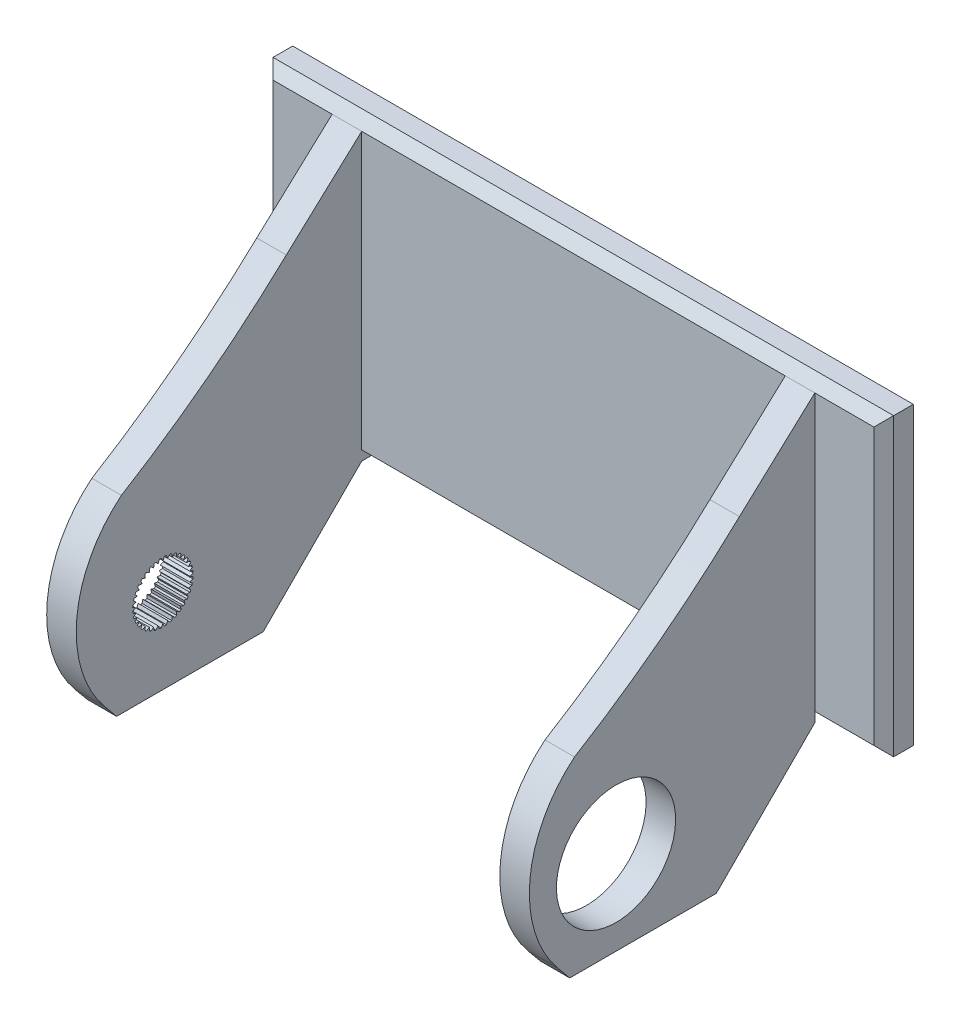
from build123d import *

# Parameters (mm, degrees)
SKETCH2_W           = 63
SKETCH2_H           = 30
BOSS_EXTRUDE2_DEPTH = 3
SKETCH6_W           = 3
SKETCH6_H           = 30
BOSS_EXTRUDE5_DEPTH = 20
SKETCH7_W           = 3
SKETCH7_H           = 23
BOSS_EXTRUDE6_DEPTH = 10
SKETCH8_W           = 3
SKETCH8_H           = 40
BOSS_EXTRUDE7_DEPTH = 15
CUT_EXTRUDE2_DEPTH  = 15
CUT_EXTRUDE3_DEPTH  = 15
CHAMFER2_SIZE       = 1
CUT_EXTRUDE4_DEPTH  = 15
SKETCH12_R          = 6.05
CUT_EXTRUDE5_DEPTH  = 10


with BuildPart() as part:
    # Sketch2 → Boss-Extrude2 (new body)
    with BuildSketch(Plane.XY):
        Rectangle(SKETCH2_W, SKETCH2_H)
    extrude(amount=BOSS_EXTRUDE2_DEPTH)

    # Sketch6 → Boss-Extrude5 (add)
    with BuildSketch(Plane.XY.offset(3)):
        with Locations((-23, 0)):
            Rectangle(SKETCH6_W, SKETCH6_H)
    boss_extrude5 = extrude(amount=BOSS_EXTRUDE5_DEPTH)

    # Sketch7 → Boss-Extrude6 (add)
    with BuildSketch(Plane.XZ.offset(15)):
        with Locations((-23, 11.5)):
            Rectangle(SKETCH7_W, SKETCH7_H)
    boss_extrude6 = extrude(amount=BOSS_EXTRUDE6_DEPTH)

    # Sketch8 → Boss-Extrude7 (add)
    with BuildSketch(Plane.XY.offset(23)):
        with Locations((-23, -5)):
            Rectangle(SKETCH8_W, SKETCH8_H)
    boss_extrude7 = extrude(amount=BOSS_EXTRUDE7_DEPTH)

    # Sketch9 → Cut-Extrude2 (cut)
    with BuildSketch(Plane.ZY.offset(24.5)):
        with BuildLine():
            Line((25.637593138, -14.932048065), (25.683905045, -14.851833488))
            Line((25.683905045, -14.851833488), (25.747581591, -14.741542475))
            ThreePointArc((25.747581591, -14.741542475), (25.693941647, -14.662338413), (25.637860115, -14.584843968))
            Line((25.637860115, -14.584843968), (25.512441803, -14.606958601))
            Line((25.512441803, -14.606958601), (25.421225152, -14.623042557))
            Line((25.421225152, -14.623042557), (25.298780115, -14.644632921))
            Line((25.298780115, -14.644632921), (25.34130483, -14.527797226))
            Line((25.34130483, -14.527797226), (25.372984041, -14.440759311))
            Line((25.372984041, -14.440759311), (25.416541363, -14.32108655))
            ThreePointArc((25.416541363, -14.32108655), (25.349962689, -14.252400254), (25.281276393, -14.18582158))
            Line((25.281276393, -14.18582158), (25.161603633, -14.229378903))
            Line((25.161603633, -14.229378903), (25.074565717, -14.261058113))
            Line((25.074565717, -14.261058113), (24.957730022, -14.303582829))
            Line((24.957730022, -14.303582829), (24.979320386, -14.181137791))
            Line((24.979320386, -14.181137791), (24.995404343, -14.08992114))
            Line((24.995404343, -14.08992114), (25.017518975, -13.964502828))
            ThreePointArc((25.017518975, -13.964502828), (24.940024531, -13.908421297), (24.860820468, -13.854781352))
            Line((24.860820468, -13.854781352), (24.750529456, -13.918457898))
            Line((24.750529456, -13.918457898), (24.670314879, -13.964769806))
            Line((24.670314879, -13.964769806), (24.56263852, -14.02693678))
            Line((24.56263852, -14.02693678), (24.56263852, -13.902602831))
            Line((24.56263852, -13.902602831), (24.56263852, -13.809979016))
            Line((24.56263852, -13.809979016), (24.56263852, -13.682625924))
            ThreePointArc((24.56263852, -13.682625924), (24.476582935, -13.640853166), (24.389267681, -13.601781774))
            Line((24.389267681, -13.601781774), (24.291709553, -13.683642764))
            Line((24.291709553, -13.683642764), (24.220755594, -13.743180204))
            Line((24.220755594, -13.743180204), (24.125510263, -13.823100527))
            Line((24.125510263, -13.823100527), (24.1039199, -13.700655489))
            Line((24.1039199, -13.700655489), (24.087835943, -13.609438838))
            Line((24.087835943, -13.609438838), (24.065721311, -13.484020526))
            ThreePointArc((24.065721311, -13.484020526), (23.973719339, -13.457825786), (23.880945925, -13.434510111))
            Line((23.880945925, -13.434510111), (23.799084936, -13.532068239))
            Line((23.799084936, -13.532068239), (23.739547495, -13.603022198))
            Line((23.739547495, -13.603022198), (23.659627173, -13.698267529))
            Line((23.659627173, -13.698267529), (23.617102458, -13.581431834))
            Line((23.617102458, -13.581431834), (23.585423247, -13.494393919))
            Line((23.585423247, -13.494393919), (23.541865925, -13.374721158))
            ThreePointArc((23.541865925, -13.374721158), (23.446713001, -13.364900349), (23.351300299, -13.358048826))
            Line((23.351300299, -13.358048826), (23.287623753, -13.468339839))
            Line((23.287623753, -13.468339839), (23.241311846, -13.548554415))
            Line((23.241311846, -13.548554415), (23.179144871, -13.656230774))
            Line((23.179144871, -13.656230774), (23.116977896, -13.548554415))
            Line((23.116977896, -13.548554415), (23.070665989, -13.468339839))
            Line((23.070665989, -13.468339839), (23.006989443, -13.358048826))
            ThreePointArc((23.006989443, -13.358048826), (22.911576741, -13.364900349), (22.816423817, -13.374721158))
            Line((22.816423817, -13.374721158), (22.772866495, -13.494393919))
            Line((22.772866495, -13.494393919), (22.741187284, -13.581431834))
            Line((22.741187284, -13.581431834), (22.698662569, -13.698267529))
            Line((22.698662569, -13.698267529), (22.618742247, -13.603022198))
            Line((22.618742247, -13.603022198), (22.559204806, -13.532068239))
            Line((22.559204806, -13.532068239), (22.477343817, -13.434510111))
            ThreePointArc((22.477343817, -13.434510111), (22.384570403, -13.457825786), (22.292568431, -13.484020526))
            Line((22.292568431, -13.484020526), (22.270453799, -13.609438838))
            Line((22.270453799, -13.609438838), (22.254369843, -13.700655489))
            Line((22.254369843, -13.700655489), (22.232779479, -13.823100527))
            Line((22.232779479, -13.823100527), (22.137534148, -13.743180204))
            Line((22.137534148, -13.743180204), (22.066580189, -13.683642764))
            Line((22.066580189, -13.683642764), (21.969022061, -13.601781774))
            ThreePointArc((21.969022061, -13.601781774), (21.881706807, -13.640853166), (21.795651222, -13.682625924))
            Line((21.795651222, -13.682625924), (21.795651222, -13.809979016))
            Line((21.795651222, -13.809979016), (21.795651222, -13.902602831))
            Line((21.795651222, -13.902602831), (21.795651222, -14.02693678))
            Line((21.795651222, -14.02693678), (21.687974863, -13.964769806))
            Line((21.687974863, -13.964769806), (21.607760286, -13.918457898))
            Line((21.607760286, -13.918457898), (21.497469274, -13.854781352))
            ThreePointArc((21.497469274, -13.854781352), (21.418265211, -13.908421297), (21.340770767, -13.964502828))
            Line((21.340770767, -13.964502828), (21.362885399, -14.08992114))
            Line((21.362885399, -14.08992114), (21.378969356, -14.181137791))
            Line((21.378969356, -14.181137791), (21.40055972, -14.303582829))
            Line((21.40055972, -14.303582829), (21.283724025, -14.261058113))
            Line((21.283724025, -14.261058113), (21.196686109, -14.229378903))
            Line((21.196686109, -14.229378903), (21.077013349, -14.18582158))
            ThreePointArc((21.077013349, -14.18582158), (21.008327053, -14.252400254), (20.941748379, -14.32108655))
            Line((20.941748379, -14.32108655), (20.985305701, -14.440759311))
            Line((20.985305701, -14.440759311), (21.016984912, -14.527797226))
            Line((21.016984912, -14.527797226), (21.059509627, -14.644632921))
            Line((21.059509627, -14.644632921), (20.93706459, -14.623042557))
            Line((20.93706459, -14.623042557), (20.845847939, -14.606958601))
            Line((20.845847939, -14.606958601), (20.720429627, -14.584843968))
            ThreePointArc((20.720429627, -14.584843968), (20.664348095, -14.662338413), (20.610708151, -14.741542475))
            Line((20.610708151, -14.741542475), (20.674384697, -14.851833488))
            Line((20.674384697, -14.851833488), (20.720696604, -14.932048065))
            Line((20.720696604, -14.932048065), (20.782863579, -15.039724423))
            Line((20.782863579, -15.039724423), (20.658529629, -15.039724423))
            Line((20.658529629, -15.039724423), (20.565905815, -15.039724423))
            Line((20.565905815, -15.039724423), (20.438552723, -15.039724423))
            ThreePointArc((20.438552723, -15.039724423), (20.396779965, -15.125780009), (20.357708573, -15.213095262))
            Line((20.357708573, -15.213095262), (20.439569562, -15.31065339))
            Line((20.439569562, -15.31065339), (20.499107003, -15.381607349))
            Line((20.499107003, -15.381607349), (20.579027325, -15.47685268))
            Line((20.579027325, -15.47685268), (20.456582288, -15.498443044))
            Line((20.456582288, -15.498443044), (20.365365637, -15.514527001))
            Line((20.365365637, -15.514527001), (20.239947325, -15.536641633))
            ThreePointArc((20.239947325, -15.536641633), (20.213752584, -15.628643604), (20.190436909, -15.721417018))
            Line((20.190436909, -15.721417018), (20.287995038, -15.803278008))
            Line((20.287995038, -15.803278008), (20.358948996, -15.862815448))
            Line((20.358948996, -15.862815448), (20.454194327, -15.942735771))
            Line((20.454194327, -15.942735771), (20.337358632, -15.985260486))
            Line((20.337358632, -15.985260486), (20.250320717, -16.016939696))
            Line((20.250320717, -16.016939696), (20.130647957, -16.060497019))
            ThreePointArc((20.130647957, -16.060497019), (20.120827148, -16.155649942), (20.113975625, -16.251062644))
            Line((20.113975625, -16.251062644), (20.224266637, -16.31473919))
            Line((20.224266637, -16.31473919), (20.304481214, -16.361051098))
            Line((20.304481214, -16.361051098), (20.412157573, -16.423218073))
            Line((20.412157573, -16.423218073), (20.304481214, -16.485385047))
            Line((20.304481214, -16.485385047), (20.224266637, -16.531696955))
            Line((20.224266637, -16.531696955), (20.113975625, -16.595373501))
            ThreePointArc((20.113975625, -16.595373501), (20.120827148, -16.690786203), (20.130647957, -16.785939126))
            Line((20.130647957, -16.785939126), (20.250320717, -16.829496449))
            Line((20.250320717, -16.829496449), (20.337358632, -16.861175659))
            Line((20.337358632, -16.861175659), (20.454194327, -16.903700374))
            Line((20.454194327, -16.903700374), (20.358948996, -16.983620697))
            Line((20.358948996, -16.983620697), (20.287995038, -17.043158137))
            Line((20.287995038, -17.043158137), (20.190436909, -17.125019127))
            ThreePointArc((20.190436909, -17.125019127), (20.213752584, -17.217792541), (20.239947325, -17.309794512))
            Line((20.239947325, -17.309794512), (20.365365637, -17.331909144))
            Line((20.365365637, -17.331909144), (20.456582288, -17.347993101))
            Line((20.456582288, -17.347993101), (20.579027325, -17.369583465))
            Line((20.579027325, -17.369583465), (20.499107003, -17.464828796))
            Line((20.499107003, -17.464828796), (20.439569562, -17.535782755))
            Line((20.439569562, -17.535782755), (20.357708573, -17.633340883))
            ThreePointArc((20.357708573, -17.633340883), (20.396779965, -17.720656136), (20.438552723, -17.806711722))
            Line((20.438552723, -17.806711722), (20.565905815, -17.806711722))
            Line((20.565905815, -17.806711722), (20.658529629, -17.806711722))
            Line((20.658529629, -17.806711722), (20.782863579, -17.806711722))
            Line((20.782863579, -17.806711722), (20.720696604, -17.91438808))
            Line((20.720696604, -17.91438808), (20.674384697, -17.994602657))
            Line((20.674384697, -17.994602657), (20.610708151, -18.10489367))
            ThreePointArc((20.610708151, -18.10489367), (20.664348095, -18.184097732), (20.720429627, -18.261592177))
            Line((20.720429627, -18.261592177), (20.845847939, -18.239477544))
            Line((20.845847939, -18.239477544), (20.93706459, -18.223393588))
            Line((20.93706459, -18.223393588), (21.059509627, -18.201803224))
            Line((21.059509627, -18.201803224), (21.016984912, -18.318638919))
            Line((21.016984912, -18.318638919), (20.985305701, -18.405676834))
            Line((20.985305701, -18.405676834), (20.941748379, -18.525349595))
            ThreePointArc((20.941748379, -18.525349595), (21.008327053, -18.594035891), (21.077013349, -18.660614565))
            Line((21.077013349, -18.660614565), (21.196686109, -18.617057242))
            Line((21.196686109, -18.617057242), (21.283724025, -18.585378032))
            Line((21.283724025, -18.585378032), (21.40055972, -18.542853316))
            Line((21.40055972, -18.542853316), (21.378969356, -18.665298354))
            Line((21.378969356, -18.665298354), (21.362885399, -18.756515005))
            Line((21.362885399, -18.756515005), (21.340770767, -18.881933317))
            ThreePointArc((21.340770767, -18.881933317), (21.418265211, -18.938014848), (21.497469274, -18.991654793))
            Line((21.497469274, -18.991654793), (21.607760286, -18.927978247))
            Line((21.607760286, -18.927978247), (21.687974863, -18.881666339))
            Line((21.687974863, -18.881666339), (21.795651222, -18.819499365))
            Line((21.795651222, -18.819499365), (21.795651222, -18.943833314))
            Line((21.795651222, -18.943833314), (21.795651222, -19.036457129))
            Line((21.795651222, -19.036457129), (21.795651222, -19.163810221))
            ThreePointArc((21.795651222, -19.163810221), (21.881706807, -19.205582979), (21.969022061, -19.244654371))
            Line((21.969022061, -19.244654371), (22.066580189, -19.162793381))
            Line((22.066580189, -19.162793381), (22.137534148, -19.103255941))
            Line((22.137534148, -19.103255941), (22.232779479, -19.023335618))
            Line((22.232779479, -19.023335618), (22.254369843, -19.145780656))
            Line((22.254369843, -19.145780656), (22.270453799, -19.236997307))
            Line((22.270453799, -19.236997307), (22.292568431, -19.362415619))
            ThreePointArc((22.292568431, -19.362415619), (22.384570403, -19.388610359), (22.477343817, -19.411926034))
            Line((22.477343817, -19.411926034), (22.559204806, -19.314367906))
            Line((22.559204806, -19.314367906), (22.618742247, -19.243413947))
            Line((22.618742247, -19.243413947), (22.698662569, -19.148168616))
            Line((22.698662569, -19.148168616), (22.741187284, -19.265004311))
            Line((22.741187284, -19.265004311), (22.772866495, -19.352042226))
            Line((22.772866495, -19.352042226), (22.816423817, -19.471714987))
            ThreePointArc((22.816423817, -19.471714987), (22.911576741, -19.481535796), (23.006989443, -19.488387319))
            Line((23.006989443, -19.488387319), (23.070665989, -19.378096306))
            Line((23.070665989, -19.378096306), (23.116977896, -19.29788173))
            Line((23.116977896, -19.29788173), (23.179144871, -19.190205371))
            Line((23.179144871, -19.190205371), (23.241311846, -19.29788173))
            Line((23.241311846, -19.29788173), (23.287623753, -19.378096306))
            Line((23.287623753, -19.378096306), (23.351300299, -19.488387319))
            ThreePointArc((23.351300299, -19.488387319), (23.446713001, -19.481535796), (23.541865925, -19.471714987))
            Line((23.541865925, -19.471714987), (23.585423247, -19.352042226))
            Line((23.585423247, -19.352042226), (23.617102458, -19.265004311))
            Line((23.617102458, -19.265004311), (23.659627173, -19.148168616))
            Line((23.659627173, -19.148168616), (23.739547495, -19.243413947))
            Line((23.739547495, -19.243413947), (23.799084936, -19.314367906))
            Line((23.799084936, -19.314367906), (23.880945925, -19.411926034))
            ThreePointArc((23.880945925, -19.411926034), (23.973719339, -19.388610359), (24.065721311, -19.362415619))
            Line((24.065721311, -19.362415619), (24.087835943, -19.236997307))
            Line((24.087835943, -19.236997307), (24.1039199, -19.145780656))
            Line((24.1039199, -19.145780656), (24.125510263, -19.023335618))
            Line((24.125510263, -19.023335618), (24.220755594, -19.103255941))
            Line((24.220755594, -19.103255941), (24.291709553, -19.162793381))
            Line((24.291709553, -19.162793381), (24.389267681, -19.244654371))
            ThreePointArc((24.389267681, -19.244654371), (24.476582935, -19.205582979), (24.56263852, -19.163810221))
            Line((24.56263852, -19.163810221), (24.56263852, -19.036457129))
            Line((24.56263852, -19.036457129), (24.56263852, -18.943833314))
            Line((24.56263852, -18.943833314), (24.56263852, -18.819499365))
            Line((24.56263852, -18.819499365), (24.670314879, -18.881666339))
            Line((24.670314879, -18.881666339), (24.750529456, -18.927978247))
            Line((24.750529456, -18.927978247), (24.860820468, -18.991654793))
            ThreePointArc((24.860820468, -18.991654793), (24.940024531, -18.938014848), (25.017518975, -18.881933317))
            Line((25.017518975, -18.881933317), (24.995404343, -18.756515005))
            Line((24.995404343, -18.756515005), (24.979320386, -18.665298354))
            Line((24.979320386, -18.665298354), (24.957730022, -18.542853316))
            Line((24.957730022, -18.542853316), (25.074565717, -18.585378032))
            Line((25.074565717, -18.585378032), (25.161603633, -18.617057242))
            Line((25.161603633, -18.617057242), (25.281276393, -18.660614565))
            ThreePointArc((25.281276393, -18.660614565), (25.349962689, -18.594035891), (25.416541363, -18.525349595))
            Line((25.416541363, -18.525349595), (25.372984041, -18.405676834))
            Line((25.372984041, -18.405676834), (25.34130483, -18.318638919))
            Line((25.34130483, -18.318638919), (25.298780115, -18.201803224))
            Line((25.298780115, -18.201803224), (25.421225152, -18.223393588))
            Line((25.421225152, -18.223393588), (25.512441803, -18.239477544))
            Line((25.512441803, -18.239477544), (25.637860115, -18.261592177))
            ThreePointArc((25.637860115, -18.261592177), (25.693941647, -18.184097732), (25.747581591, -18.10489367))
            Line((25.747581591, -18.10489367), (25.683905045, -17.994602657))
            Line((25.683905045, -17.994602657), (25.637593138, -17.91438808))
            Line((25.637593138, -17.91438808), (25.575426163, -17.806711722))
            Line((25.575426163, -17.806711722), (25.699760113, -17.806711722))
            Line((25.699760113, -17.806711722), (25.792383928, -17.806711722))
            Line((25.792383928, -17.806711722), (25.919737019, -17.806711722))
            ThreePointArc((25.919737019, -17.806711722), (25.961509777, -17.720656136), (26.000581169, -17.633340883))
            Line((26.000581169, -17.633340883), (25.91872018, -17.535782755))
            Line((25.91872018, -17.535782755), (25.859182739, -17.464828796))
            Line((25.859182739, -17.464828796), (25.779262417, -17.369583465))
            Line((25.779262417, -17.369583465), (25.901707454, -17.347993101))
            Line((25.901707454, -17.347993101), (25.992924105, -17.331909144))
            Line((25.992924105, -17.331909144), (26.118342417, -17.309794512))
            ThreePointArc((26.118342417, -17.309794512), (26.144537158, -17.217792541), (26.167852833, -17.125019127))
            Line((26.167852833, -17.125019127), (26.070294704, -17.043158137))
            Line((26.070294704, -17.043158137), (25.999340746, -16.983620697))
            Line((25.999340746, -16.983620697), (25.904095415, -16.903700374))
            Line((25.904095415, -16.903700374), (26.02093111, -16.861175659))
            Line((26.02093111, -16.861175659), (26.107969025, -16.829496449))
            Line((26.107969025, -16.829496449), (26.227641785, -16.785939126))
            ThreePointArc((26.227641785, -16.785939126), (26.237462594, -16.690786203), (26.244314117, -16.595373501))
            Line((26.244314117, -16.595373501), (26.134023105, -16.531696955))
            Line((26.134023105, -16.531696955), (26.053808528, -16.485385047))
            Line((26.053808528, -16.485385047), (25.946132169, -16.423218073))
            Line((25.946132169, -16.423218073), (26.053808528, -16.361051098))
            Line((26.053808528, -16.361051098), (26.134023105, -16.31473919))
            Line((26.134023105, -16.31473919), (26.244314117, -16.251062644))
            ThreePointArc((26.244314117, -16.251062644), (26.237462594, -16.155649942), (26.227641785, -16.060497019))
            Line((26.227641785, -16.060497019), (26.107969025, -16.016939696))
            Line((26.107969025, -16.016939696), (26.02093111, -15.985260486))
            Line((26.02093111, -15.985260486), (25.904095415, -15.942735771))
            Line((25.904095415, -15.942735771), (25.999340746, -15.862815448))
            Line((25.999340746, -15.862815448), (26.070294704, -15.803278008))
            Line((26.070294704, -15.803278008), (26.167852833, -15.721417018))
            ThreePointArc((26.167852833, -15.721417018), (26.144537158, -15.628643604), (26.118342417, -15.536641633))
            Line((26.118342417, -15.536641633), (25.992924105, -15.514527001))
            Line((25.992924105, -15.514527001), (25.901707454, -15.498443044))
            Line((25.901707454, -15.498443044), (25.779262417, -15.47685268))
            Line((25.779262417, -15.47685268), (25.859182739, -15.381607349))
            Line((25.859182739, -15.381607349), (25.91872018, -15.31065339))
            Line((25.91872018, -15.31065339), (26.000581169, -15.213095262))
            ThreePointArc((26.000581169, -15.213095262), (25.961509777, -15.125780009), (25.919737019, -15.039724423))
            Line((25.919737019, -15.039724423), (25.792383928, -15.039724423))
            Line((25.792383928, -15.039724423), (25.699760113, -15.039724423))
            Line((25.699760113, -15.039724423), (25.575426163, -15.039724423))
            Line((25.575426163, -15.039724423), (25.637593138, -14.932048065))
        make_face()
    cut_extrude2 = extrude(amount=-CUT_EXTRUDE2_DEPTH, mode=Mode.SUBTRACT)

    # Sketch10 → Cut-Extrude3 (cut)
    with BuildSketch(Plane.ZY.offset(24.5)):
        with BuildLine():
            ThreePointArc((27.392981546, -5.808626129), (31.91865842, -14.28970274), (29.121768443, -23.48686633))
            Line((29.121768443, -23.48686633), (27.878216059, -25))
            Line((27.878216059, -25), (38, -25))
            Line((38, -25), (38, 15))
            Line((38, 15), (3, 15))
            ThreePointArc((3, 15), (14.365462469, 3.621511227), (27.392981546, -5.808626129))
        make_face()
        Polygon((0, -25), (13, -25), (3, -15), (0, -15), align=None)
    cut_extrude3 = extrude(amount=-CUT_EXTRUDE3_DEPTH, mode=Mode.SUBTRACT)

    # Chamfer2
    chamfer2_edges = [part.edges().sort_by_distance(p)[0] for p in [
        (31.5, 0, 3),
        (5, -15, 3),
        (-28, 15, 3),
        (5, 15, 3),
        (-31.5, 0, 3),
        (-28, -15, 3),
    ]]
    chamfer(chamfer2_edges, length=CHAMFER2_SIZE)

    # Sketch11 → Cut-Extrude4 (cut)
    with BuildSketch(Plane.ZY.offset(24.5)):
        Polygon((2, 15), (3, 14), (12.323915854, 5.411029954), (3, 15), align=None)
    cut_extrude4 = extrude(amount=-CUT_EXTRUDE4_DEPTH, mode=Mode.SUBTRACT)

    # Mirror1: Boss-Extrude5, Boss-Extrude6, Boss-Extrude7 across plane
    add(boss_extrude5.mirror(Plane(origin=(0, 0, 0), x_dir=(0, 0, 1), z_dir=(1, 0, 0))))
    add(boss_extrude6.mirror(Plane(origin=(0, 0, 0), x_dir=(0, 0, 1), z_dir=(1, 0, 0))))
    add(boss_extrude7.mirror(Plane(origin=(0, 0, 0), x_dir=(0, 0, 1), z_dir=(1, 0, 0))))

    # Mirror2: Cut-Extrude2, Cut-Extrude3, Cut-Extrude4 across plane
    add(cut_extrude2.mirror(Plane(origin=(0, 0, 0), x_dir=(0, 0, 1), z_dir=(1, 0, 0))), mode=Mode.SUBTRACT)
    add(cut_extrude3.mirror(Plane(origin=(0, 0, 0), x_dir=(0, 0, 1), z_dir=(1, 0, 0))), mode=Mode.SUBTRACT)
    add(cut_extrude4.mirror(Plane(origin=(0, 0, 0), x_dir=(0, 0, 1), z_dir=(1, 0, 0))), mode=Mode.SUBTRACT)

    # Sketch12 → Cut-Extrude5 (cut)
    with BuildSketch(Plane(origin=(24.5, 0, 0), x_dir=(0, 0, -1), z_dir=(1, 0, 0))):
        with Locations(Location((-23.179144871, -16.423218073, 0), (0, 0, 90))):
            Circle(SKETCH12_R)
    extrude(amount=-CUT_EXTRUDE5_DEPTH, mode=Mode.SUBTRACT)


solid = part.part
